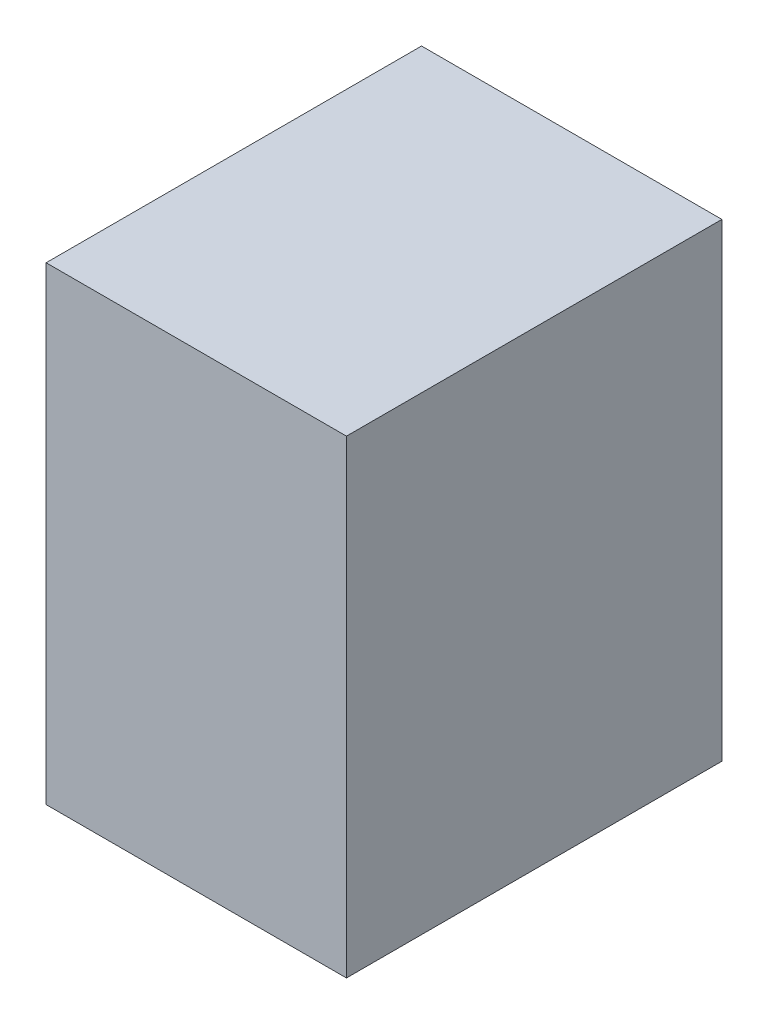
from build123d import *

# Parameters (mm, degrees)
SKETCH1_W           = 32
SKETCH1_H           = 50
BOSS_EXTRUDE1_DEPTH = 40


with BuildPart() as part:
    # Sketch1 → Boss-Extrude1 (new body)
    with BuildSketch(Plane.XY):
        Rectangle(SKETCH1_W, SKETCH1_H)
    extrude(amount=-BOSS_EXTRUDE1_DEPTH)


solid = part.part
